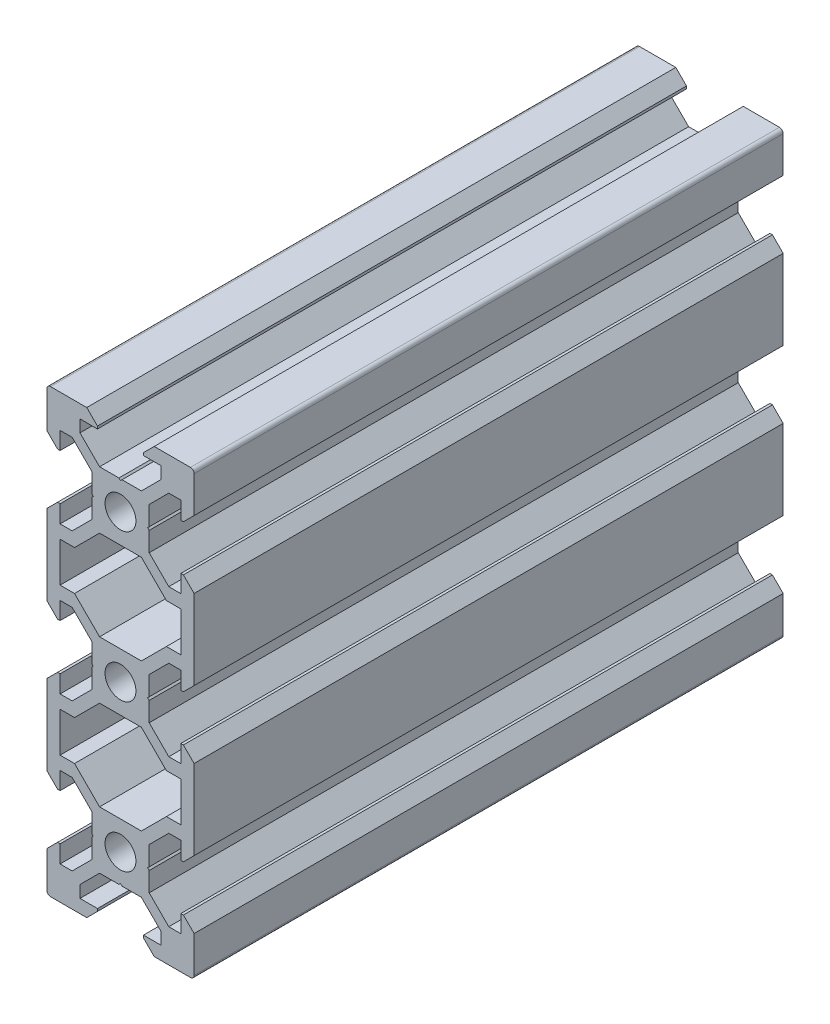
from build123d import *

# Parameters (mm, degrees)
SKETCH1_R           = 2.1
BOSS_EXTRUDE1_DEPTH = 80


with BuildPart() as part:
    # Sketch1 → Boss-Extrude1 (new body)
    with BuildSketch(Plane.XY.offset(500)):
        with BuildLine():
            Line((6.560660172, 14.5), (3.9, 17.160660172))
            Line((3.9, 17.160660172), (3.9, 19.79))
            Line((3.9, 19.79), (3.69, 20))
            Line((3.69, 20), (3.9, 20.21))
            Line((3.9, 20.21), (3.9, 22.839339828))
            Line((3.9, 22.839339828), (6.560660172, 25.5))
            Line((6.560660172, 25.5), (8.2, 25.5))
            Line((8.2, 25.5), (8.2, 23.125))
            Line((8.2, 23.125), (8.545, 23.125))
            Line((8.545, 23.125), (10, 24.58))
            Line((10, 24.58), (10, 29.5))
            ThreePointArc((10, 29.5), (9.853553391, 29.853553391), (9.5, 30))
            Line((9.5, 30), (4.58, 30))
            Line((4.58, 30), (3.125, 28.545))
            Line((3.125, 28.545), (3.125, 28.2))
            Line((3.125, 28.2), (5.5, 28.2))
            Line((5.5, 28.2), (5.5, 26.560660172))
            Line((5.5, 26.560660172), (2.839339828, 23.9))
            Line((2.839339828, 23.9), (0.21, 23.9))
            Line((0.21, 23.9), (0, 23.69))
            Line((0, 23.69), (-0.21, 23.9))
            Line((-0.21, 23.9), (-2.839339828, 23.9))
            Line((-2.839339828, 23.9), (-5.5, 26.560660172))
            Line((-5.5, 26.560660172), (-5.5, 28.2))
            Line((-5.5, 28.2), (-3.125, 28.2))
            Line((-3.125, 28.2), (-3.125, 28.545))
            Line((-3.125, 28.545), (-4.58, 30))
            Line((-4.58, 30), (-9.5, 30))
            ThreePointArc((-9.5, 30), (-9.853553391, 29.853553391), (-10, 29.5))
            Line((-10, 29.5), (-10, 24.58))
            Line((-10, 24.58), (-8.545, 23.125))
            Line((-8.545, 23.125), (-8.2, 23.125))
            Line((-8.2, 23.125), (-8.2, 25.5))
            Line((-8.2, 25.5), (-6.560660172, 25.5))
            Line((-6.560660172, 25.5), (-3.9, 22.839339828))
            Line((-3.9, 22.839339828), (-3.9, 20.21))
            Line((-3.9, 20.21), (-3.69, 20))
            Line((-3.69, 20), (-3.9, 19.79))
            Line((-3.9, 19.79), (-3.9, 17.160660172))
            Line((-3.9, 17.160660172), (-6.560660172, 14.5))
            Line((-6.560660172, 14.5), (-8.2, 14.5))
            Line((-8.2, 14.5), (-8.2, 16.875))
            Line((-8.2, 16.875), (-8.545, 16.875))
            Line((-8.545, 16.875), (-10, 15.42))
            Line((-10, 15.42), (-10, 4.58))
            Line((-10, 4.58), (-8.545, 3.125))
            Line((-8.545, 3.125), (-8.2, 3.125))
            Line((-8.2, 3.125), (-8.2, 5.5))
            Line((-8.2, 5.5), (-6.560660172, 5.5))
            Line((-6.560660172, 5.5), (-3.9, 2.839339828))
            Line((-3.9, 2.839339828), (-3.9, 0.21))
            Line((-3.9, 0.21), (-3.69, 0))
            Line((-3.69, 0), (-3.9, -0.21))
            Line((-3.9, -0.21), (-3.9, -2.839339828))
            Line((-3.9, -2.839339828), (-6.560660172, -5.5))
            Line((-6.560660172, -5.5), (-8.2, -5.5))
            Line((-8.2, -5.5), (-8.2, -3.125))
            Line((-8.2, -3.125), (-8.545, -3.125))
            Line((-8.545, -3.125), (-10, -4.58))
            Line((-10, -4.58), (-10, -15.42))
            Line((-10, -15.42), (-8.545, -16.875))
            Line((-8.545, -16.875), (-8.2, -16.875))
            Line((-8.2, -16.875), (-8.2, -14.5))
            Line((-8.2, -14.5), (-6.560660172, -14.5))
            Line((-6.560660172, -14.5), (-3.9, -17.160660172))
            Line((-3.9, -17.160660172), (-3.9, -19.79))
            Line((-3.9, -19.79), (-3.69, -20))
            Line((-3.69, -20), (-3.9, -20.21))
            Line((-3.9, -20.21), (-3.9, -22.839339828))
            Line((-3.9, -22.839339828), (-6.560660172, -25.5))
            Line((-6.560660172, -25.5), (-8.2, -25.5))
            Line((-8.2, -25.5), (-8.2, -23.125))
            Line((-8.2, -23.125), (-8.545, -23.125))
            Line((-8.545, -23.125), (-10, -24.58))
            Line((-10, -24.58), (-10, -29.5))
            ThreePointArc((-10, -29.5), (-9.853553391, -29.853553391), (-9.5, -30))
            Line((-9.5, -30), (-4.58, -30))
            Line((-4.58, -30), (-3.125, -28.545))
            Line((-3.125, -28.545), (-3.125, -28.2))
            Line((-3.125, -28.2), (-5.5, -28.2))
            Line((-5.5, -28.2), (-5.5, -26.560660172))
            Line((-5.5, -26.560660172), (-2.839339828, -23.9))
            Line((-2.839339828, -23.9), (-0.21, -23.9))
            Line((-0.21, -23.9), (0, -23.69))
            Line((0, -23.69), (0.21, -23.9))
            Line((0.21, -23.9), (2.839339828, -23.9))
            Line((2.839339828, -23.9), (5.5, -26.560660172))
            Line((5.5, -26.560660172), (5.5, -28.2))
            Line((5.5, -28.2), (3.125, -28.2))
            Line((3.125, -28.2), (3.125, -28.545))
            Line((3.125, -28.545), (4.58, -30))
            Line((4.58, -30), (9.5, -30))
            ThreePointArc((9.5, -30), (9.853553391, -29.853553391), (10, -29.5))
            Line((10, -29.5), (10, -24.58))
            Line((10, -24.58), (8.545, -23.125))
            Line((8.545, -23.125), (8.2, -23.125))
            Line((8.2, -23.125), (8.2, -25.5))
            Line((8.2, -25.5), (6.560660172, -25.5))
            Line((6.560660172, -25.5), (3.9, -22.839339828))
            Line((3.9, -22.839339828), (3.9, -20.21))
            Line((3.9, -20.21), (3.69, -20))
            Line((3.69, -20), (3.9, -19.79))
            Line((3.9, -19.79), (3.9, -17.160660172))
            Line((3.9, -17.160660172), (6.560660172, -14.5))
            Line((6.560660172, -14.5), (8.2, -14.5))
            Line((8.2, -14.5), (8.2, -16.875))
            Line((8.2, -16.875), (8.545, -16.875))
            Line((8.545, -16.875), (10, -15.42))
            Line((10, -15.42), (10, -4.58))
            Line((10, -4.58), (8.545, -3.125))
            Line((8.545, -3.125), (8.2, -3.125))
            Line((8.2, -3.125), (8.2, -5.5))
            Line((8.2, -5.5), (6.560660172, -5.5))
            Line((6.560660172, -5.5), (3.9, -2.839339828))
            Line((3.9, -2.839339828), (3.9, -0.21))
            Line((3.9, -0.21), (3.69, 0))
            Line((3.69, 0), (3.9, 0.21))
            Line((3.9, 0.21), (3.9, 2.839339828))
            Line((3.9, 2.839339828), (6.560660172, 5.5))
            Line((6.560660172, 5.5), (8.2, 5.5))
            Line((8.2, 5.5), (8.2, 3.125))
            Line((8.2, 3.125), (8.545, 3.125))
            Line((8.545, 3.125), (10, 4.58))
            Line((10, 4.58), (10, 15.42))
            Line((10, 15.42), (8.545, 16.875))
            Line((8.545, 16.875), (8.2, 16.875))
            Line((8.2, 16.875), (8.2, 14.5))
            Line((8.2, 14.5), (6.560660172, 14.5))
        make_face()
        with Locations(Location((0, 20, 0), (0, 0, 180))):
            Circle(SKETCH1_R, mode=Mode.SUBTRACT)
        with Locations(Location((0, 0, 0), (0, 0, 180))):
            Circle(SKETCH1_R, mode=Mode.SUBTRACT)
        with Locations(Location((0, -20, 0), (0, 0, 180))):
            Circle(SKETCH1_R, mode=Mode.SUBTRACT)
        Polygon((2.839339828, 3.9), (-2.839339828, 3.9), (-6.239339828, 7.3), (-8.2, 7.3), (-8.2, 12.7), (-6.239339828, 12.7), (-2.839339828, 16.1), (2.839339828, 16.1), (6.239339828, 12.7), (8.2, 12.7), (8.2, 7.3), (6.239339828, 7.3), align=None, mode=Mode.SUBTRACT)
        Polygon((2.839339828, -16.1), (-2.839339828, -16.1), (-6.239339828, -12.7), (-8.2, -12.7), (-8.2, -7.3), (-6.239339828, -7.3), (-2.839339828, -3.9), (2.839339828, -3.9), (6.239339828, -7.3), (8.2, -7.3), (8.2, -12.7), (6.239339828, -12.7), align=None, mode=Mode.SUBTRACT)
    extrude(amount=-BOSS_EXTRUDE1_DEPTH)


solid = part.part
